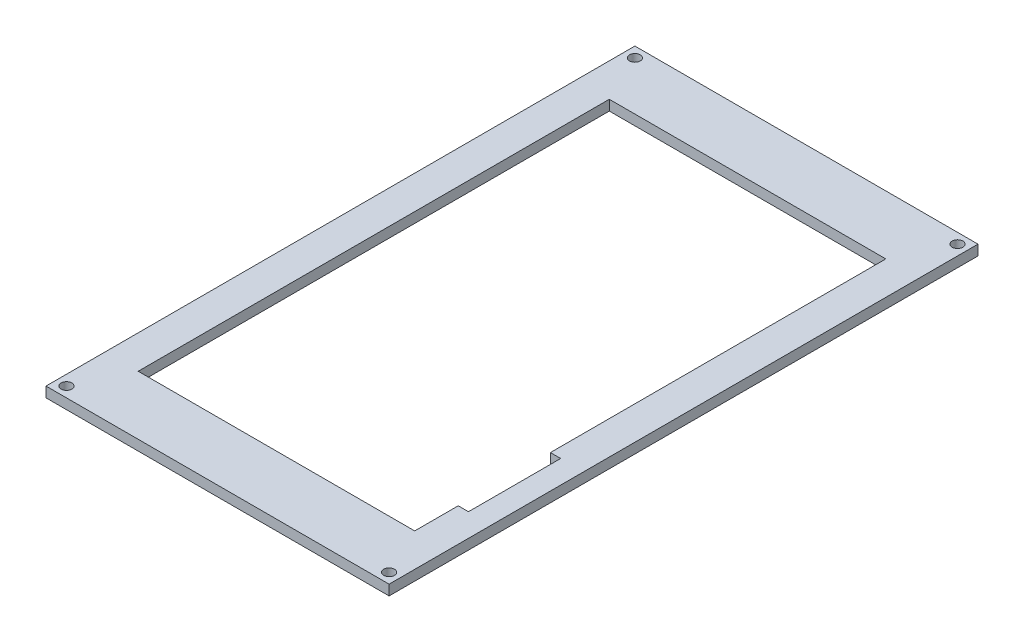
from build123d import *

# Parameters (mm, degrees)
SKETCH_1_W      = 67
SKETCH_1_H      = 115
SKETCH_1_R      = 1.05
EXTRUDE_1_DEPTH = 2


with BuildPart() as part:
    # 草图1 → 凸台-拉伸1 (new body)
    with BuildSketch(Plane(origin=(0, 0, 0), x_dir=(1, 0, 0), z_dir=(0, 1, 0))):
        with Locations((33.5, -57.5)):
            Rectangle(SKETCH_1_W, SKETCH_1_H)
        with Locations(Location((2, -113, 0), (0, 0, 270))):
            Circle(SKETCH_1_R, mode=Mode.SUBTRACT)
        with Locations(Location((65, -113, 0), (0, 0, 270))):
            Circle(SKETCH_1_R, mode=Mode.SUBTRACT)
        Polygon((6.5, -103.5), (6.5, -11.5), (60.5, -11.5), (60.5, -77), (62.5, -77), (62.5, -95), (60.5, -95), (60.5, -103.5), align=None, mode=Mode.SUBTRACT)
        with Locations(Location((2, -2, 0), (0, 0, 270))):
            Circle(SKETCH_1_R, mode=Mode.SUBTRACT)
        with Locations(Location((65, -2, 0), (0, 0, 270))):
            Circle(SKETCH_1_R, mode=Mode.SUBTRACT)
    extrude(amount=EXTRUDE_1_DEPTH)


solid = part.part
